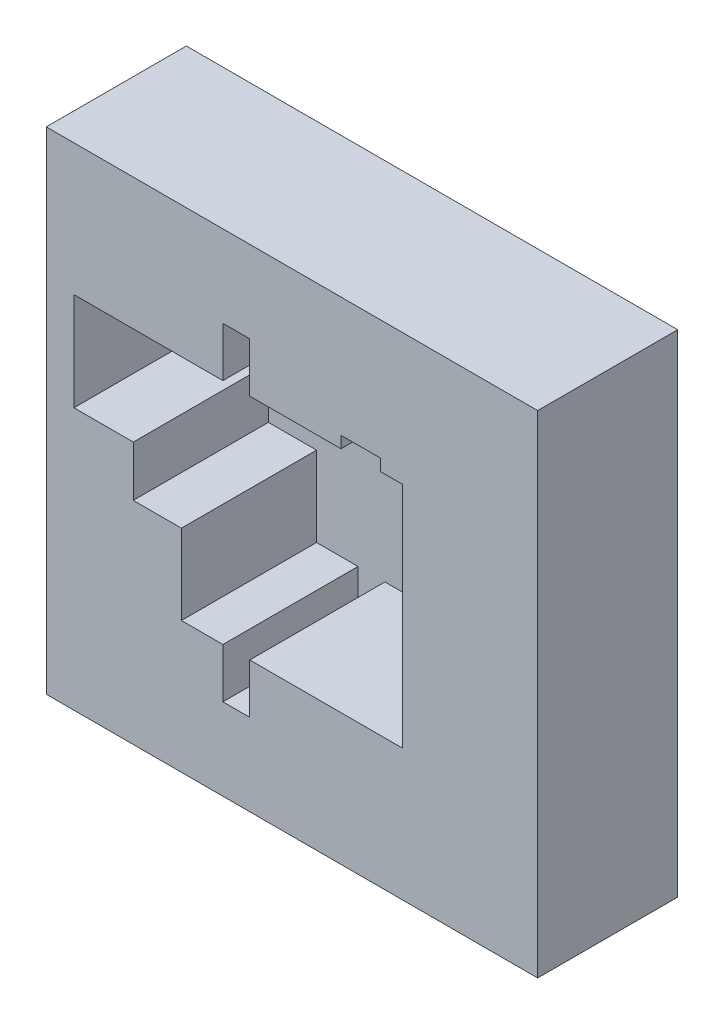
from build123d import *

# Parameters (mm, degrees)
SKETCH1_W           = 50.8
SKETCH1_H           = 50.8
BOSS_EXTRUDE1_DEPTH = 14.478
SKETCH3_W           = 6.134078845
SKETCH3_H           = 10.131279463
SKETCH3_W_2         = 4.974615739
SKETCH3_H_2         = 3.542535777
SKETCH3_W_3         = 2.775050154
SKETCH3_H_3         = 5.132822303
SKETCH3_H_4         = 5.129144124
SKETCH3_W_4         = 11.43
SKETCH3_H_5         = 11.811
SKETCH3_W_5         = 4.097064437
SKETCH3_H_6         = 1.20756089
CUT_EXTRUDE1_DEPTH  = 13.97


with BuildPart() as part:
    # Sketch1 → Boss-Extrude1 (new body)
    with BuildSketch(Plane.XY):
        with Locations((-22.928187919, 27.871812081)):
            Rectangle(SKETCH1_W, SKETCH1_H)
    extrude(amount=BOSS_EXTRUDE1_DEPTH)

    # Sketch3 → Cut-Extrude1 (cut)
    with BuildSketch(Plane.XY.offset(14.478)):
        with Locations((-42.399843081, 34.61717235)):
            Rectangle(SKETCH3_W, SKETCH3_H)
        Polygon((-39.332803658, 27.871812081), (-34.358187919, 27.871812081), (-34.358187919, 39.682812081), (-39.332803658, 39.682812081), (-39.332803658, 29.551532618), align=None)
        Polygon((-22.928187919, 27.871812081), (-22.928187919, 39.682812081), (-27.293419188, 39.682812081), (-30.068469342, 39.682812081), (-34.358187919, 39.682812081), (-34.358187919, 27.871812081), align=None)
        Polygon((-17.868746746, 39.682812081), (-22.928187919, 39.682812081), (-22.928187919, 27.871812081), (-11.498187919, 27.871812081), (-11.498187919, 39.682812081), (-13.771682309, 39.682812081), align=None)
        Polygon((-22.928187919, 16.060812081), (-22.928187919, 27.871812081), (-34.358187919, 27.871812081), (-34.358187919, 24.329276304), (-34.358187919, 16.060812081), (-30.068469342, 16.060812081), (-27.293419188, 16.060812081), align=None)
        with Locations((-36.845495789, 26.100544193)):
            Rectangle(SKETCH3_W_2, SKETCH3_H_2)
        with Locations((-28.680944265, 13.49440093)):
            Rectangle(SKETCH3_W_3, SKETCH3_H_3)
        with Locations((-28.680944265, 42.247384143)):
            Rectangle(SKETCH3_W_3, SKETCH3_H_4)
        with Locations((-17.213187919, 21.966312081)):
            Rectangle(SKETCH3_W_4, SKETCH3_H_5)
        with Locations((-15.820214527, 40.286592526)):
            Rectangle(SKETCH3_W_5, SKETCH3_H_6)
    extrude(amount=-CUT_EXTRUDE1_DEPTH, mode=Mode.SUBTRACT)


solid = part.part
